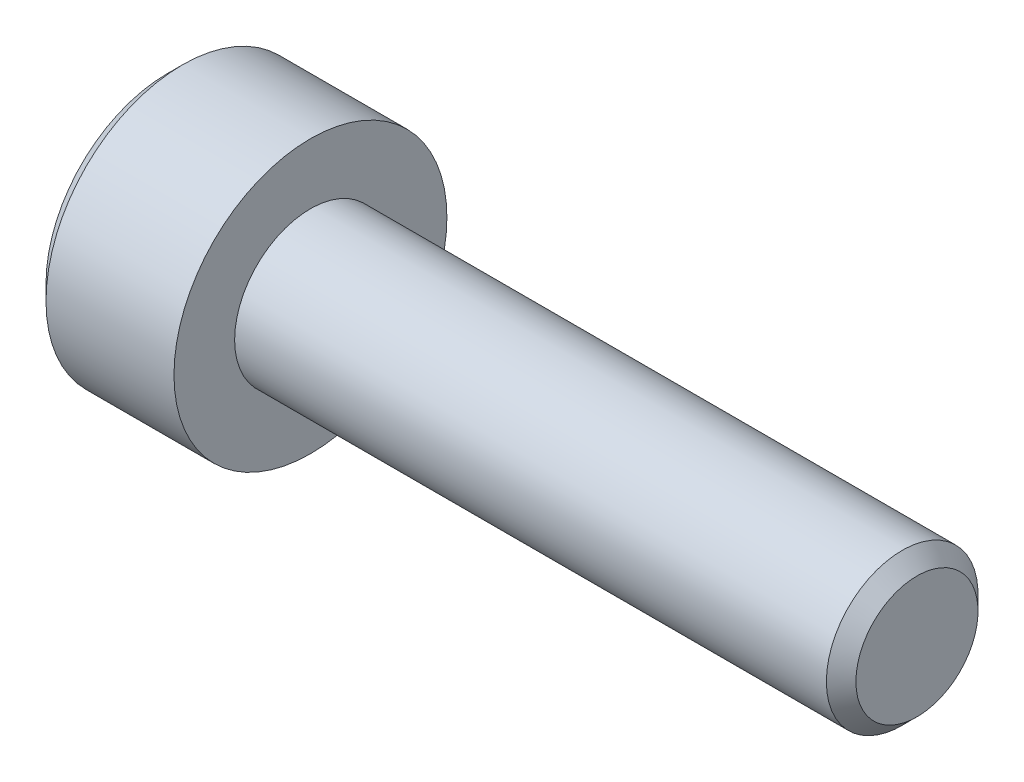
from build123d import *

# Parameters (mm, degrees)
CUT_EXTRUDE_1_DEPTH = 1.1


with BuildPart() as part:
    # 草图1 → 旋转1 (revolve)
    with BuildSketch(Plane.XY):
        Polygon((-2.36, 0), (-2.36, 2), (-2.11, 2.25), (0, 2.25), (0, 1.25), (9.7565, 1.25), (10, 1.0065), (10, 0), align=None)
    revolve(axis=Axis((10, 0, 0), (-1, 0, 0)))

    # 草图2 → 切除-拉伸1 (cut)
    with BuildSketch(Plane(origin=(-2.36, 0, 0), x_dir=(0, 0, -1), z_dir=(1, 0, 0))):
        Polygon((-1, 0.577350269), (-1, -0.577350269), (0, -1.154700538), (1, -0.577350269), (1, 0.577350269), (0, 1.154700538), align=None)
    extrude(amount=CUT_EXTRUDE_1_DEPTH, mode=Mode.SUBTRACT)

    # 草图3 → 切除-旋转1 (revolve, cut)
    with BuildSketch(Plane.XY):
        Polygon((-1.26, 0), (-1.26, 1), (-0.682649731, 0), align=None)
    revolve(axis=Axis((-0.682649731, 0, 0), (-1, 0, 0)), mode=Mode.SUBTRACT)


solid = part.part
